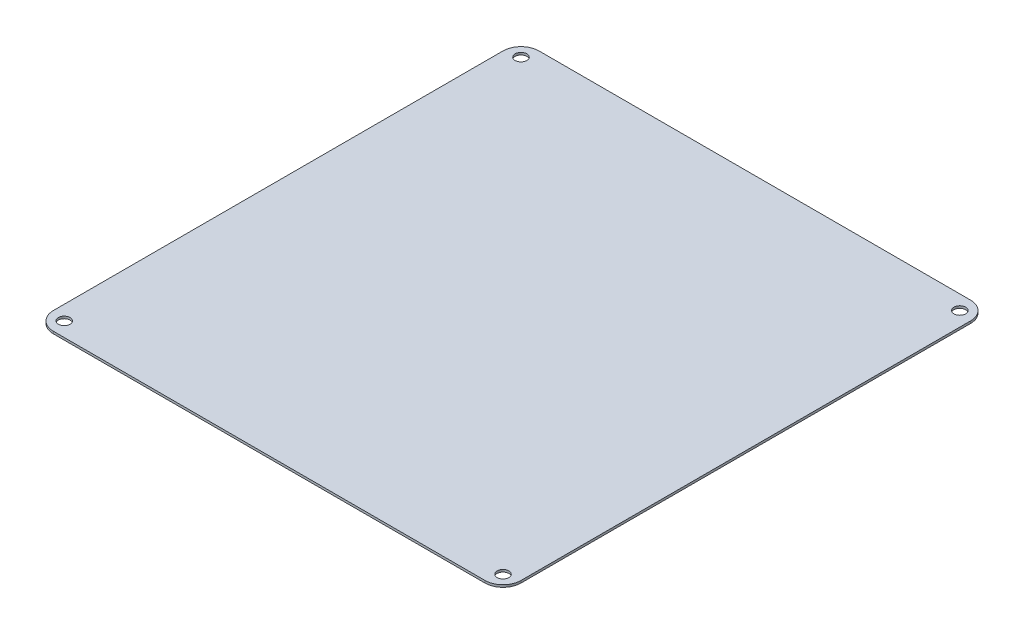
from build123d import *

# Parameters (mm, degrees)
SKETCH1_W           = 260
SKETCH1_H           = 270
BOSS_EXTRUDE1_DEPTH = 1.27
SKETCH2_R           = 3.25
CUT_EXTRUDE1_DEPTH  = 188.42095107
FILLET1_R           = 10


with BuildPart() as part:
    # Sketch1 → Boss-Extrude1 (new body)
    with BuildSketch(Plane(origin=(0, 0, 0), x_dir=(1, 0, 0), z_dir=(0, 1, 0))):
        Rectangle(SKETCH1_W, SKETCH1_H)
    extrude(amount=BOSS_EXTRUDE1_DEPTH)

    # Sketch2 → Cut-Extrude1 (cut, through all)
    with BuildSketch(Plane(origin=(0, 1.27, 0), x_dir=(1, 0, 0), z_dir=(0, 1, 0))):
        with Locations(Location((-122, 127, 0), (0, 0, 270))):
            Circle(SKETCH2_R)
        with Locations(Location((122, 127, 0), (0, 0, 270))):
            Circle(SKETCH2_R)
        with Locations(Location((122, -127, 0), (0, 0, 270))):
            Circle(SKETCH2_R)
        with Locations(Location((-122, -127, 0), (0, 0, 270))):
            Circle(SKETCH2_R)
    extrude(amount=-CUT_EXTRUDE1_DEPTH, mode=Mode.SUBTRACT)

    # Fillet1
    fillet1_edges = [part.edges().sort_by_distance(p)[0] for p in [
        (-130, 0.635, -135),
        (130, 0.635, -135),
        (130, 0.635, 135),
        (-130, 0.635, 135),
    ]]
    fillet(fillet1_edges, radius=FILLET1_R)


solid = part.part
